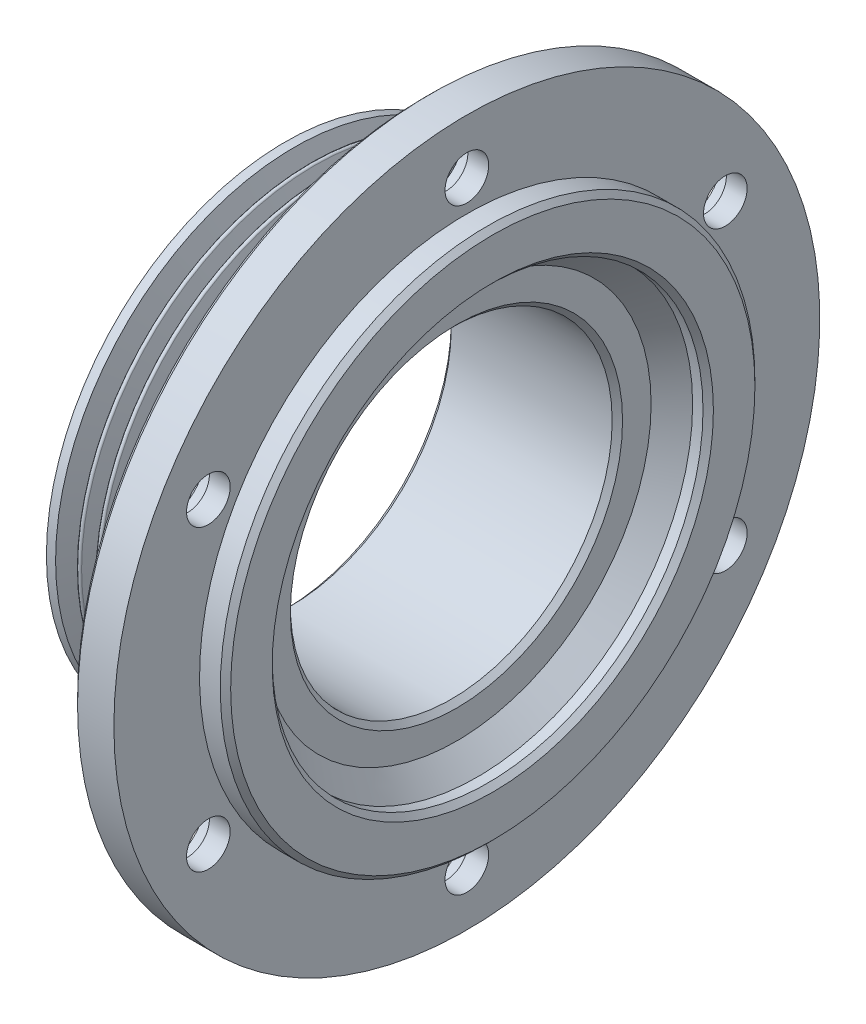
from build123d import *

# Parameters (mm, degrees)
PATTERN_LINEAR_1_COUNT      = 5
PATTERN_LINEAR_1_PITCH      = 3.56
HOLE_WIZARD_M81_D           = 8.4
HOLE_WIZARD_M81_CBORE_D     = 15
HOLE_WIZARD_M81_CBORE_DEPTH = 4
PATTERN_CIRCULAR_1_COUNT    = 6
SKETCH_7_R                  = 41.5
CUT_EXTRUDE_2_DEPTH         = 2
FILLET_1_R                  = 0.4
SKETCH_8_W                  = 5
SKETCH_8_H                  = 10
CHAMFER_1_SIZE              = 4
CHAMFER_2_SIZE              = 1
CHAMFER_3_SIZE              = 1
CHAMFER_4_SIZE              = 1
FILLET_5_R                  = 2
FILLET_6_R                  = 0.4


with BuildPart() as part:
    # Эскиз1 → Повернуть1 (revolve)
    with BuildSketch(Plane.XY, mode=Mode.PRIVATE) as revolve_1_sk:
        Polygon((-13.5, 46), (13.5, 46), (13.5, 68), (21.5, 68), (21.5, 31), (-13.5, 31), align=None)
    revolve(revolve_1_sk.sketch.rotate(Axis((0, 0, 0), (1, 0, 0)), 90), axis=Axis((0, 0, 0), (1, 0, 0)))

    # Эскиз2 → Вырез-Повернуть1 (revolve, cut)
    with BuildSketch(Plane.XY, mode=Mode.PRIVATE) as cut_revolve_1_sk:
        Polygon((-11.732118241, 46), (-9.94, 41.0761956), (-8.147881759, 46), align=None)
    cut_revolve_1 = revolve(cut_revolve_1_sk.sketch.rotate(Axis((0, 0, 0), (-1, 0, 0)), 270), axis=Axis((0, 0, 0), (-1, 0, 0)), mode=Mode.SUBTRACT)

    # Линейный массив1: Вырез-Повернуть1 ×5
    with Locations(*[(i * PATTERN_LINEAR_1_PITCH, 0, 0) for i in range(1, PATTERN_LINEAR_1_COUNT)]):
        add(cut_revolve_1, mode=Mode.SUBTRACT)

    # Цековка для винта с внутренним шестигранником M81 (through all)
    with Locations(Plane.ZY.offset(-13.5)):
        with Locations((0, 57.5)):
            hole_wizard_m81 = CounterBoreHole(HOLE_WIZARD_M81_D / 2, HOLE_WIZARD_M81_CBORE_D / 2, HOLE_WIZARD_M81_CBORE_DEPTH)

    # Круговой массив1: Цековка для винта с внутренним шестигранником M81 ×6 about axis
    pattern_circular_1_axis = Axis((0, 0, 0), (1, 0, 0))
    for i in range(1, PATTERN_CIRCULAR_1_COUNT):
        add(hole_wizard_m81.rotate(pattern_circular_1_axis, i * 360 / PATTERN_CIRCULAR_1_COUNT), mode=Mode.SUBTRACT)

    # Эскиз7 → Вырез-Вытянуть2 (cut)
    with BuildSketch(Plane(origin=(21.5, 0, 0), x_dir=(0, 0, -1), z_dir=(1, 0, 0))):
        Circle(SKETCH_7_R)
    extrude(amount=-CUT_EXTRUDE_2_DEPTH, mode=Mode.SUBTRACT)

    # Скругление1
    fillet_1_edges = [part.edges().sort_by_distance(p)[0] for p in [
        (-9.94, 0, -41.0761956),
        (-6.38, 0, -41.0761956),
        (-2.82, 0, -41.0761956),
        (0.74, 0, -41.0761956),
        (4.3, 0, -41.0761956),
    ]]
    fillet(fillet_1_edges, radius=FILLET_1_R)

    # Эскиз8 → Повернуть2 (revolve)
    with BuildSketch(Plane.XY, mode=Mode.PRIVATE) as revolve_2_sk:
        with Locations((24, 46.5)):
            Rectangle(SKETCH_8_W, SKETCH_8_H)
    revolve(revolve_2_sk.sketch.rotate(Axis((0, 0, 0), (1, 0, 0)), 270), axis=Axis((0, 0, 0), (1, 0, 0)))

    # Фаска1
    chamfer_1_edges = [part.edges().sort_by_distance(p)[0] for p in [
        (19.5, 0, 41.5),
    ]]
    chamfer(chamfer_1_edges, length=CHAMFER_1_SIZE)

    # Фаска2
    chamfer_2_edges = [part.edges().sort_by_distance(p)[0] for p in [
        (26.5, 0, 51.5),
    ]]
    chamfer(chamfer_2_edges, length=CHAMFER_2_SIZE)

    # Фаска3
    chamfer_3_edges = [part.edges().sort_by_distance(p)[0] for p in [
        (13.5, 0, -68),
    ]]
    chamfer(chamfer_3_edges, length=CHAMFER_3_SIZE)

    # Фаска4
    chamfer_4_edges = [part.edges().sort_by_distance(p)[0] for p in [
        (26.5, 0, 41.5),
        (-13.5, 0, -31),
        (19.5, 0, -31),
    ]]
    chamfer(chamfer_4_edges, length=CHAMFER_4_SIZE)

    # Скругление5
    fillet_5_edges = [part.edges().sort_by_distance(p)[0] for p in [
        (13.5, 0, -46),
    ]]
    fillet(fillet_5_edges, radius=FILLET_5_R)

    # Скругление6
    fillet_6_edges = [part.edges().sort_by_distance(p)[0] for p in [
        (-8.16, 0, -45.966705406),
        (-4.6, 0, -45.966705406),
        (-1.04, 0, -45.966705406),
        (2.52, 0, -45.966705406),
    ]]
    fillet(fillet_6_edges, radius=FILLET_6_R)


solid = part.part
